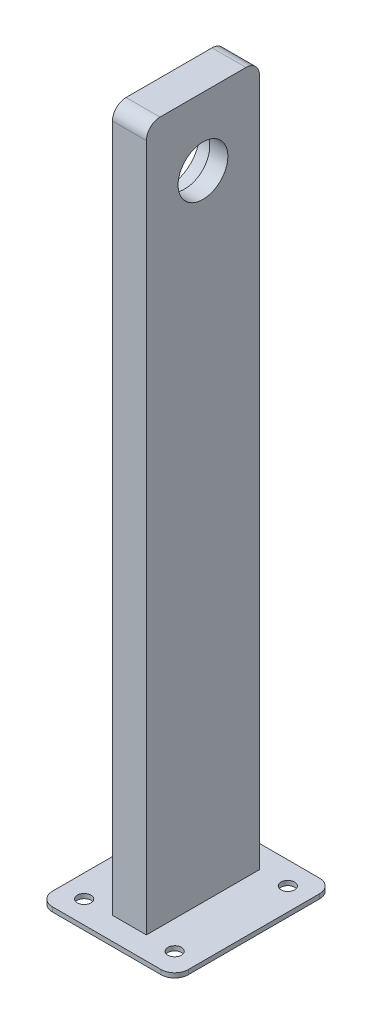
from build123d import *

# Parameters (mm, degrees)
SKETCH1_W           = 15
SKETCH1_H           = 50
BOSS_EXTRUDE1_DEPTH = 310
SKETCH2_W           = 60
SKETCH2_H           = 70
BOSS_EXTRUDE2_DEPTH = 2
SKETCH4_R           = 3
CUT_EXTRUDE1_DEPTH  = 2
FILLET1_R           = 6
SKETCH5_R           = 13.5
CUT_EXTRUDE2_DEPTH  = 7
SKETCH6_R           = 11
CUT_EXTRUDE3_DEPTH  = 314.456934841
FILLET2_R           = 6


with BuildPart() as part:
    # Sketch1 → Boss-Extrude1 (new body)
    with BuildSketch(Plane(origin=(0, 0, 0), x_dir=(1, 0, 0), z_dir=(0, 1, 0))):
        Rectangle(SKETCH1_W, SKETCH1_H)
    extrude(amount=BOSS_EXTRUDE1_DEPTH)

    # Sketch2 → Boss-Extrude2 (add)
    with BuildSketch(Plane(origin=(0, 0, 0), x_dir=(-1, 0, 0), z_dir=(0, -1, 0))):
        Rectangle(SKETCH2_W, SKETCH2_H)
    extrude(amount=BOSS_EXTRUDE2_DEPTH)

    # Sketch4 → Cut-Extrude1 (cut)
    with BuildSketch(Plane(origin=(0, 0, 0), x_dir=(1, 0, 0), z_dir=(0, 1, 0))):
        with Locations(Location((20, -25, 0), (0, 0, 270))):
            Circle(SKETCH4_R)
        with Locations(Location((-20, -25, 0), (0, 0, 90))):
            Circle(SKETCH4_R)
        with Locations(Location((-20, 25, 0), (0, 0, 270))):
            Circle(SKETCH4_R)
        with Locations(Location((20, 25, 0), (0, 0, 90))):
            Circle(SKETCH4_R)
    extrude(amount=-CUT_EXTRUDE1_DEPTH, mode=Mode.SUBTRACT)

    # Fillet1
    fillet1_edges = [part.edges().sort_by_distance(p)[0] for p in [
        (-30, -1, 35),
        (-30, -1, -35),
        (30, -1, -35),
        (30, -1, 35),
    ]]
    fillet(fillet1_edges, radius=FILLET1_R)

    # Sketch5 → Cut-Extrude2 (cut)
    with BuildSketch(Plane.ZY.offset(7.5)):
        with Locations((0, 280)):
            Circle(SKETCH5_R)
    extrude(amount=-CUT_EXTRUDE2_DEPTH, mode=Mode.SUBTRACT)

    # Sketch6 → Cut-Extrude3 (cut, through all)
    with BuildSketch(Plane.ZY.offset(0.5)):
        with Locations((0, 280)):
            Circle(SKETCH6_R)
    extrude(amount=-CUT_EXTRUDE3_DEPTH, mode=Mode.SUBTRACT)

    # Fillet2
    fillet2_edges = [part.edges().sort_by_distance(p)[0] for p in [
        (0, 310, 25),
        (0, 310, -25),
    ]]
    fillet(fillet2_edges, radius=FILLET2_R)


solid = part.part
